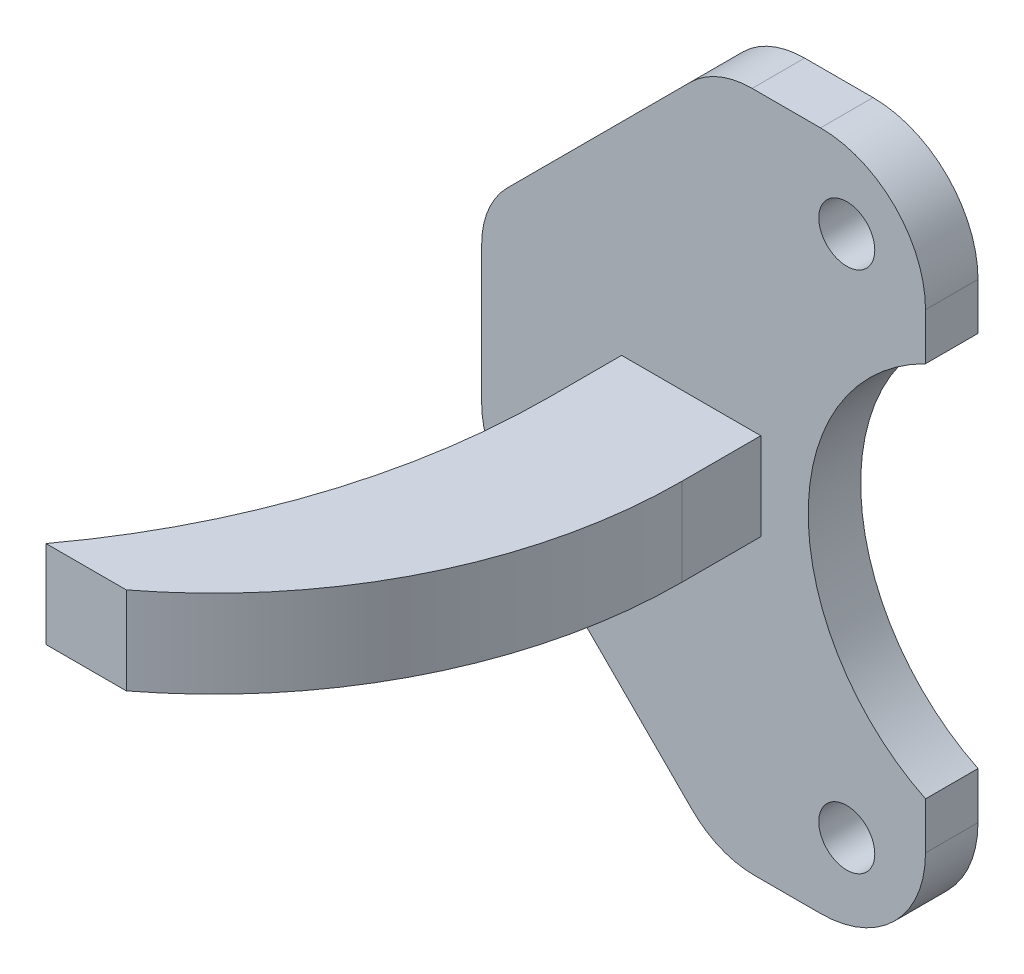
from build123d import *

# Parameters (mm, degrees)
SKETCH1_R           = 1.6
BOSS_EXTRUDE1_DEPTH = 3
BOSS_EXTRUDE2_DEPTH = 2.5


with BuildPart() as part:
    # Sketch1 → Boss-Extrude1 (new body)
    with BuildSketch(Plane.XY):
        with BuildLine():
            Line((41.5, -10.768201729), (41.5, -13.444086969))
            ThreePointArc((41.5, -13.444086969), (39.742640687, -17.686727656), (35.5, -19.444086969))
            Line((35.5, -19.444086969), (31.703672228, -19.444086969))
            ThreePointArc((31.703672228, -19.444086969), (29.790255066, -19.063484632), (28.168138322, -17.979620875))
            Line((28.168138322, -17.979620875), (17.597242638, -7.408725191))
            ThreePointArc((17.597242638, -7.408725191), (16.513378881, -5.786608447), (16.132776544, -3.873191285))
            Line((16.132776544, -3.873191285), (16.132776544, 3.984673091))
            ThreePointArc((16.132776544, 3.984673091), (16.513378881, 5.898090253), (17.597242638, 7.520206997))
            Line((17.597242638, 7.520206997), (28.056656516, 17.979620875))
            ThreePointArc((28.056656516, 17.979620875), (29.67877326, 19.063484632), (31.592190422, 19.444086969))
            Line((31.592190422, 19.444086969), (35.5, 19.444086969))
            ThreePointArc((35.5, 19.444086969), (39.742640687, 17.686727656), (41.5, 13.444086969))
            Line((41.5, 13.444086969), (41.5, 10.768201729))
            ThreePointArc((41.5, 10.768201729), (34.795831523, 0), (41.5, -10.768201729))
        make_face()
        with Locations((37, 14.944086969)):
            Circle(SKETCH1_R, mode=Mode.SUBTRACT)
        with Locations((37, -14.944086969)):
            Circle(SKETCH1_R, mode=Mode.SUBTRACT)
    extrude(amount=BOSS_EXTRUDE1_DEPTH)

    # Sketch2 → Boss-Extrude2 (add, symmetric)
    with BuildSketch(Plane(origin=(0, 0, 0), x_dir=(1, 0, 0), z_dir=(0, 1, 0))):
        with BuildLine():
            Line((32.08575566, -3), (32.08575566, -7.515745333))
            ThreePointArc((32.08575566, -7.515745333), (29.317171973, -19.366233959), (21.584586927, -28.76337527))
            Line((21.584586927, -28.76337527), (16.996844286, -28.76337527))
            ThreePointArc((16.996844286, -28.76337527), (22.302728229, -18.521432225), (24.132776544, -7.132809616))
            Line((24.132776544, -7.132809616), (24.132776544, -3))
            Line((24.132776544, -3), (32.08575566, -3))
        make_face()
    extrude(amount=BOSS_EXTRUDE2_DEPTH, both=True)


solid = part.part
